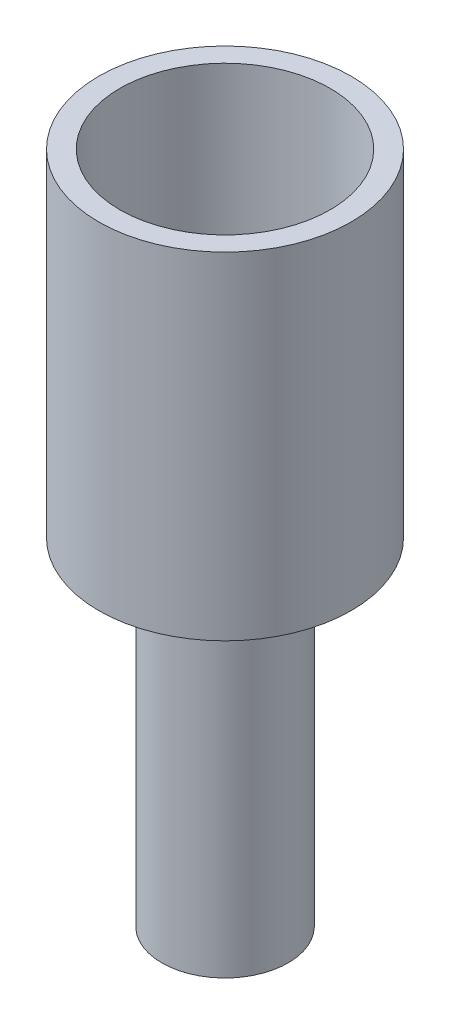
from build123d import *

# Parameters (mm, degrees)
SKETCH2_R                        = 9.525
SKETCH2_R_2                      = 4.7625
BOSS_EXTRUDE1_DEPTH              = 25.4
SKETCH2_3_R                      = 4.7625
BOSS_EXTRUDE2_DEPTH              = 25.4
F_5_8_0_625_DIAMETER_HOLE1_D     = 15.875
F_5_8_0_625_DIAMETER_HOLE1_DEPTH = 20.630668836
F_5_8_0_625_DIAMETER_HOLE1_TIP   = 4.769331164
F_1_4_0_25_DIAMETER_HOLE1_D      = 6.35


with BuildPart() as part:
    # Sketch2 → Boss-Extrude1 (new body)
    # profile 1 of 2: a face of its own
    with BuildSketch(Plane(origin=(0, 0, 0), x_dir=(1, 0, 0), z_dir=(0, 1, 0))):
        with Locations(Location((0, 0, 0), (0, 0, 270))):
            Circle(SKETCH2_R)
        Circle(SKETCH2_R_2, mode=Mode.SUBTRACT)
    # profile 2 of 2: a face of its own
    with BuildSketch(Plane(origin=(0, 0, 0), x_dir=(1, 0, 0), z_dir=(0, 1, 0))):
        Circle(SKETCH2_R_2)
    extrude(amount=BOSS_EXTRUDE1_DEPTH)

    # Sketch2<3> → Boss-Extrude2 (add)
    with BuildSketch(Plane(origin=(0, 0, 0), x_dir=(1, 0, 0), z_dir=(0, 1, 0))):
        with Locations(Location((0, 0, 0), (0, 0, 270))):
            Circle(SKETCH2_3_R)
    extrude(amount=-BOSS_EXTRUDE2_DEPTH)

    # 5/8 (0.625) Diameter Hole1
    with Locations(Plane(origin=(0, 25.4, 0), x_dir=(1, 0, 0), z_dir=(0, 1, 0))):
        with Locations((0, 0)):
            Hole(F_5_8_0_625_DIAMETER_HOLE1_D / 2, depth=F_5_8_0_625_DIAMETER_HOLE1_DEPTH)
            with Locations((0, 0, -(F_5_8_0_625_DIAMETER_HOLE1_DEPTH + F_5_8_0_625_DIAMETER_HOLE1_TIP / 2))):  # 118° drill point
                Cone(0, F_5_8_0_625_DIAMETER_HOLE1_D / 2, F_5_8_0_625_DIAMETER_HOLE1_TIP, mode=Mode.SUBTRACT)

    # 1/4 (0.25) Diameter Hole1 (through all)
    with Locations(Plane(origin=(0, -25.4, 0), x_dir=(-1, 0, 0), z_dir=(0, -1, 0))):
        with Locations((0, 0)):
            Hole(F_1_4_0_25_DIAMETER_HOLE1_D / 2)


solid = part.part
